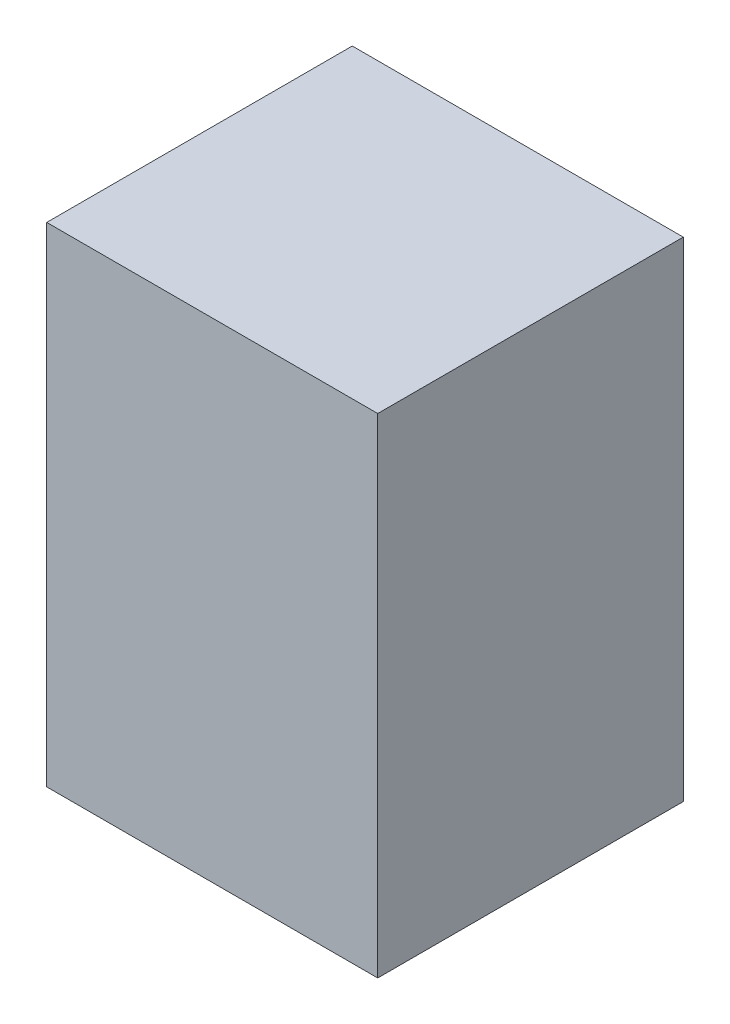
from build123d import *

# Parameters (mm, degrees)
SKETCH1_W           = 1651
SKETCH1_H           = 1524
BOSS_EXTRUDE1_DEPTH = 2438.4


with BuildPart() as part:
    # Sketch1 → Boss-Extrude1 (new body)
    with BuildSketch(Plane(origin=(0, 0, 0), x_dir=(1, 0, 0), z_dir=(0, 1, 0))):
        with Locations((825.5, 762)):
            Rectangle(SKETCH1_W, SKETCH1_H)
    extrude(amount=BOSS_EXTRUDE1_DEPTH)


solid = part.part
